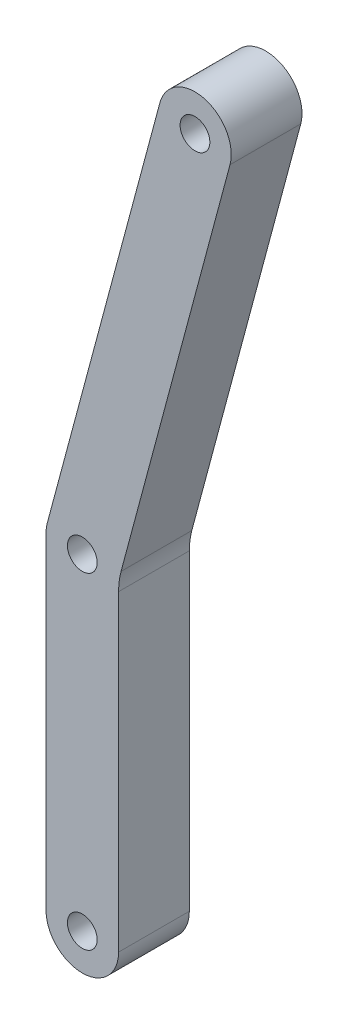
from build123d import *

# Parameters (mm, degrees)
ESQUISSE1_R        = 2.05
BOSS_EXTRU_1_DEPTH = 9.75
CONG_1_R           = 10


with BuildPart() as part:
    # Esquisse1 → Boss.-Extru.1 (new body)
    # profile 1 of 3: a face of its own
    with BuildSketch(Plane.XY):
        with BuildLine():
            Line((10.699513575, 104.249644803), (-4.829629131, 46.294095226))
            ThreePointArc((-4.829629131, 46.294095226), (0.652630961, 49.957224307), (5, 45))
            Line((5, 45), (5, 44.341737512))
            Line((5, 44.341737512), (20.358771838, 101.661454352))
            ThreePointArc((20.358771838, 101.661454352), (16.823237932, 107.785178709), (10.699513575, 104.249644803))
        make_face()
        with Locations((15.529142706, 102.955549577)):
            Circle(ESQUISSE1_R, mode=Mode.SUBTRACT)
    # profile 2 of 3: a face of its own
    with BuildSketch(Plane.XY):
        with BuildLine():
            ThreePointArc((-4.829629131, 46.294095226), (-4.957224307, 45.652630961), (-5, 45))
            ThreePointArc((-5, 45), (-0.652630961, 40.042775693), (4.829629131, 43.705904774))
            Line((4.829629131, 43.705904774), (5, 44.341737512))
            Line((5, 44.341737512), (5, 45))
            ThreePointArc((5, 45), (0.652630961, 49.957224307), (-4.829629131, 46.294095226))
        make_face()
        with Locations((0, 45)):
            Circle(ESQUISSE1_R, mode=Mode.SUBTRACT)
    # profile 3 of 3: a face of its own
    with BuildSketch(Plane.XY):
        with BuildLine():
            Line((-5, 45), (-5, 0))
            ThreePointArc((-5, 0), (0, -5), (5, 0))
            Line((5, 0), (5, 44.341737512))
            Line((5, 44.341737512), (4.829629131, 43.705904774))
            ThreePointArc((4.829629131, 43.705904774), (-0.652630961, 40.042775693), (-5, 45))
        make_face()
        Circle(ESQUISSE1_R, mode=Mode.SUBTRACT)
    extrude(amount=BOSS_EXTRU_1_DEPTH)

    # Congé1
    cong_1_edges = [part.edges().sort_by_distance(p)[0] for p in [
        (5, 44.341737512, 4.875),
    ]]
    fillet(cong_1_edges, radius=CONG_1_R)


solid = part.part
